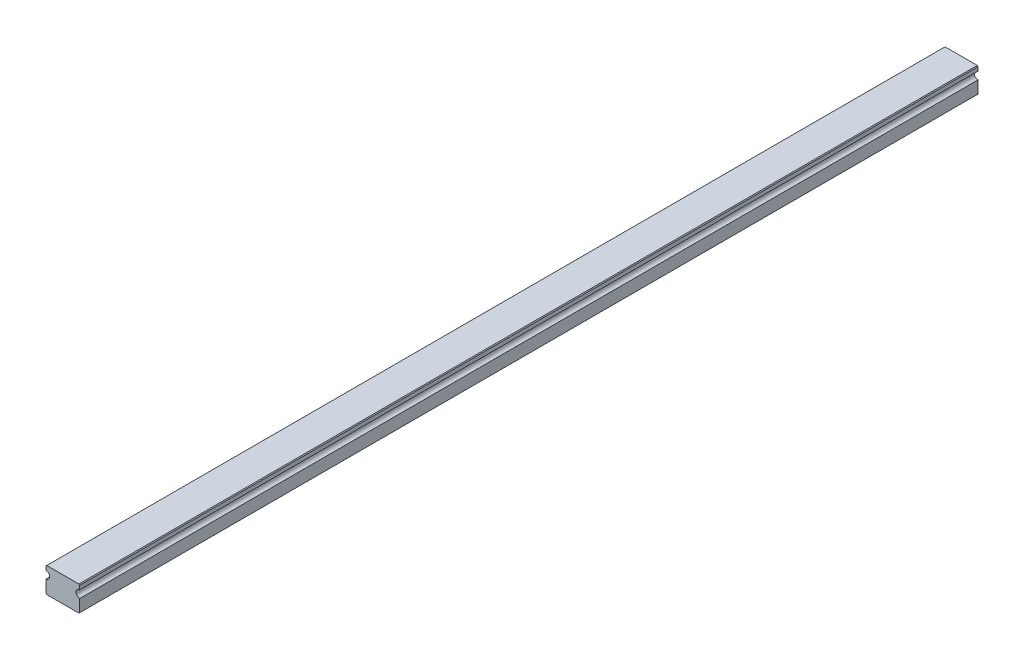
from build123d import *

# Parameters (mm, degrees)
BOSS_EXTRUDE1_DEPTH = 120


with BuildPart() as part:
    # Sketch1 → Boss-Extrude1 (new, symmetric)
    with BuildSketch(Plane.XY):
        with BuildLine():
            Line((-4.5, 0.128302789), (-4.5, -3.171697211))
            Line((-4.5, -3.171697211), (-4.3, -3.371697211))
            Line((-4.3, -3.371697211), (4.3, -3.371697211))
            Line((4.3, -3.371697211), (4.5, -3.171697211))
            Line((4.5, -3.171697211), (4.5, 0.128302789))
            ThreePointArc((4.5, 0.128302789), (3.792893219, 0.421196008), (3.5, 1.128302789))
            ThreePointArc((3.5, 1.128302789), (3.792893219, 1.83540957), (4.5, 2.128302789))
            Line((4.5, 2.128302789), (4.5, 3.171697211))
            Line((4.5, 3.171697211), (4.3, 3.371697211))
            Line((4.3, 3.371697211), (-4.3, 3.371697211))
            Line((-4.3, 3.371697211), (-4.5, 3.171697211))
            Line((-4.5, 3.171697211), (-4.5, 2.128302789))
            ThreePointArc((-4.5, 2.128302789), (-3.792893215, 1.835409567), (-3.5, 1.128302779))
            ThreePointArc((-3.5, 1.128302779), (-3.792893222, 0.421196004), (-4.5, 0.128302789))
        make_face()
    extrude(amount=BOSS_EXTRUDE1_DEPTH, both=True)


solid = part.part
